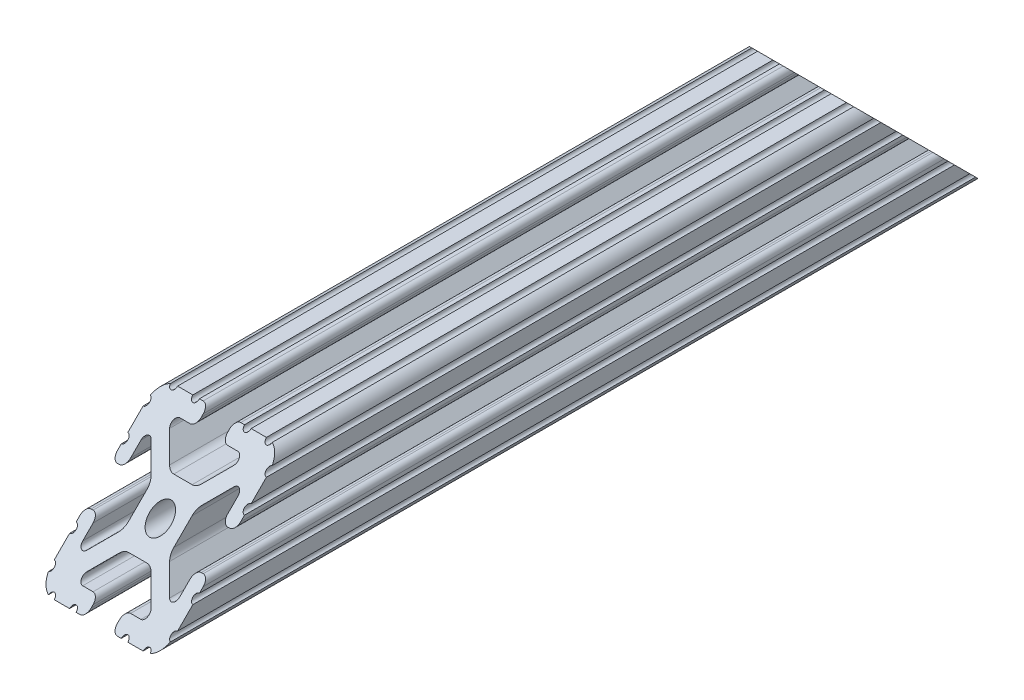
from build123d import *

# Parameters (mm, degrees)
BOSS_EXTRUDE1_DEPTH     = 304.8
CUT_EXTRUDE1_DEPTH      = 306.9883086
CUT_EXTRUDE1_DEPTH_BACK = 306.9883086
SKETCH5_R               = 1.016
CUT_EXTRUDE2_DEPTH      = 306.9883086
CUT_EXTRUDE2_DEPTH_BACK = 306.9883086


with BuildPart() as part:
    # Sketch4 → Boss-Extrude1 (new, symmetric)
    with BuildSketch(Plane.XY):
        with BuildLine():
            Line((5.7912, -19.05), (14.3002, -19.05))
            ThreePointArc((14.3002, -19.05), (17.658815789, -17.658815789), (19.05, -14.3002))
            Line((19.05, -14.3002), (19.05, -5.7912))
            ThreePointArc((19.05, -5.7912), (18.544114832, -4.569885168), (17.3228, -4.064))
            Line((17.3228, -4.064), (16.7132, -4.064))
            ThreePointArc((16.7132, -4.064), (15.491885168, -4.569885168), (14.986, -5.7912))
            Line((14.986, -5.7912), (14.986, -8.996305235))
            ThreePointArc((14.986, -8.996305235), (14.189232738, -10.188751711), (12.782646215, -9.908964256))
            Line((12.782646215, -9.908964256), (7.888897763, -5.015215804))
            ThreePointArc((7.888897763, -5.015215804), (7.219915375, -4.014012907), (6.985, -2.833013566))
            Line((6.985, -2.833013566), (6.985, 0))
            Line((6.985, 0), (3.3274, 0))
            ThreePointArc((3.3274, 0), (2.352827104, -2.352827104), (0, -3.3274))
            Line((0, -3.3274), (0, -6.985))
            Line((0, -6.985), (2.833013566, -6.985))
            ThreePointArc((2.833013566, -6.985), (4.014012907, -7.219915375), (5.015215804, -7.888897763))
            Line((5.015215804, -7.888897763), (9.908964256, -12.782646215))
            ThreePointArc((9.908964256, -12.782646215), (10.188751711, -14.189232738), (8.996305235, -14.986))
            Line((8.996305235, -14.986), (5.7912, -14.986))
            ThreePointArc((5.7912, -14.986), (4.569885168, -15.491885168), (4.064, -16.7132))
            Line((4.064, -16.7132), (4.064, -17.3228))
            ThreePointArc((4.064, -17.3228), (4.569885168, -18.544114832), (5.7912, -19.05))
        make_face()
    extrude(amount=BOSS_EXTRUDE1_DEPTH, both=True)

    # Sketch5 → Cut-Extrude1 (cut, two sides: drawn at the far end of the back side and taken through both)
    with BuildSketch(Plane.XY.offset(-CUT_EXTRUDE1_DEPTH_BACK)):
        with Locations((14.739477062, -19.05)):
            Circle(SKETCH5_R)
        with Locations((7.980305235, -19.05)):
            Circle(SKETCH5_R)
        with Locations((19.05, -14.739477062)):
            Circle(SKETCH5_R)
        with Locations((19.05, -7.980305235)):
            Circle(SKETCH5_R)
    extrude(amount=CUT_EXTRUDE1_DEPTH + CUT_EXTRUDE1_DEPTH_BACK, mode=Mode.SUBTRACT)

    # Mirror1: part across plane


with BuildPart() as part_1:
    add(part.part)
    add(part.part.mirror(Plane(origin=(0, 0, 0), x_dir=(0, 0, 1), z_dir=(1, 0, 0))))

    # Mirror2: part across plane


with BuildPart() as part_2:
    add(part_1.part)
    add(part_1.part.mirror(Plane.ZX))

    # Sketch6 → Cut-Extrude2 (cut, two sides: drawn at the far end of the back side and taken through both)
    with BuildSketch(Plane(origin=(0, 0, 0), x_dir=(0, 0, -1), z_dir=(1, 0, 0)).offset(-CUT_EXTRUDE2_DEPTH_BACK)):
        Polygon((-266.7, 19.05), (-304.8, 19.05), (-304.8, -19.05), align=None)
        Polygon((-87.536268412, 19.05), (-49.436268412, -19.05), (304.8, -19.05), (304.8, 19.05), align=None)
    extrude(amount=CUT_EXTRUDE2_DEPTH + CUT_EXTRUDE2_DEPTH_BACK, mode=Mode.SUBTRACT)


solid = part_2.part
